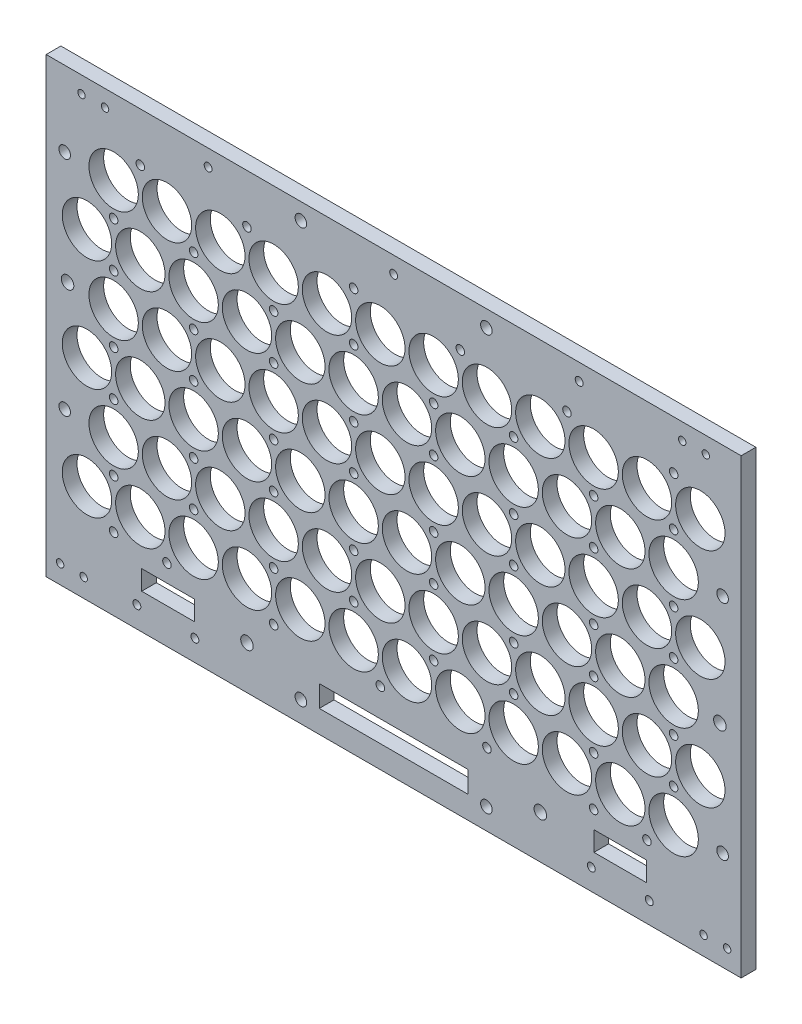
from build123d import *

# Parameters (mm, degrees)
SKETCH1_W                  = 299.700000132
SKETCH1_H                  = 194.250000104
BOSS_EXTRUDE1_DEPTH        = 6.35
SKETCH3_R                  = 10.6511979
CUT_EXTRUDE1_DEPTH         = 182.719853184
SKETCH4_R                  = 10.6511979
CUT_EXTRUDE2_DEPTH         = 182.719853184
LPATTERN1_COUNT            = 12
LPATTERN1_PITCH            = 23
LPATTERN2_COPY_1_SKETCH_R  = 10.6511979
LPATTERN2_COPY_1_DEPTH     = 182.719853184
LPATTERN2_COPY_2_SKETCH_R  = 10.6511979
LPATTERN2_COPY_2_DEPTH     = 182.719853184
LPATTERN2_COPY_3_SKETCH_R  = 10.6511979
LPATTERN2_COPY_3_DEPTH     = 182.719853184
LPATTERN2_COPY_4_SKETCH_R  = 10.6511979
LPATTERN2_COPY_4_DEPTH     = 182.719853184
LPATTERN2_COPY_5_SKETCH_R  = 10.6511979
LPATTERN2_COPY_5_DEPTH     = 182.719853184
LPATTERN2_COPY_6_SKETCH_R  = 10.6511979
LPATTERN2_COPY_6_DEPTH     = 182.719853184
LPATTERN2_COPY_7_SKETCH_R  = 10.6511979
LPATTERN2_COPY_7_DEPTH     = 182.719853184
LPATTERN2_COPY_8_SKETCH_R  = 10.6511979
LPATTERN2_COPY_8_DEPTH     = 182.719853184
LPATTERN2_COPY_9_SKETCH_R  = 10.6511979
LPATTERN2_COPY_9_DEPTH     = 182.719853184
LPATTERN2_COPY_10_SKETCH_R = 10.6511979
LPATTERN2_COPY_10_DEPTH    = 182.719853184
LPATTERN2_COPY_11_SKETCH_R = 10.6511979
LPATTERN2_COPY_11_DEPTH    = 182.719853184
LPATTERN2_COPY_12_SKETCH_R = 10.6511979
LPATTERN2_COPY_12_DEPTH    = 182.719853184
LPATTERN2_COPY_13_SKETCH_R = 10.6511979
LPATTERN2_COPY_13_DEPTH    = 182.719853184
LPATTERN2_COPY_14_SKETCH_R = 10.6511979
LPATTERN2_COPY_14_DEPTH    = 182.719853184
LPATTERN2_COPY_15_SKETCH_R = 10.6511979
LPATTERN2_COPY_15_DEPTH    = 182.719853184
LPATTERN2_COPY_16_SKETCH_R = 10.6511979
LPATTERN2_COPY_16_DEPTH    = 182.719853184
LPATTERN2_COPY_17_SKETCH_R = 10.6511979
LPATTERN2_COPY_17_DEPTH    = 182.719853184
LPATTERN2_COPY_18_SKETCH_R = 10.6511979
LPATTERN2_COPY_18_DEPTH    = 182.719853184
LPATTERN2_COPY_19_SKETCH_R = 10.6511979
LPATTERN2_COPY_19_DEPTH    = 182.719853184
LPATTERN2_COPY_20_SKETCH_R = 10.6511979
LPATTERN2_COPY_20_DEPTH    = 182.719853184
LPATTERN2_COPY_21_SKETCH_R = 10.6511979
LPATTERN2_COPY_21_DEPTH    = 182.719853184
LPATTERN2_COPY_22_SKETCH_R = 10.6511979
LPATTERN2_COPY_22_DEPTH    = 182.719853184
LPATTERN2_COPY_23_SKETCH_R = 10.6511979
LPATTERN2_COPY_23_DEPTH    = 182.719853184
LPATTERN2_COPY_24_SKETCH_R = 10.6511979
LPATTERN2_COPY_24_DEPTH    = 182.719853184
LPATTERN2_COPY_25_SKETCH_R = 10.6511979
LPATTERN2_COPY_25_DEPTH    = 182.719853184
LPATTERN2_COPY_26_SKETCH_R = 10.6511979
LPATTERN2_COPY_26_DEPTH    = 182.719853184
LPATTERN2_COPY_27_SKETCH_R = 10.6511979
LPATTERN2_COPY_27_DEPTH    = 182.719853184
LPATTERN2_COPY_28_SKETCH_R = 10.6511979
LPATTERN2_COPY_28_DEPTH    = 182.719853184
LPATTERN2_COPY_29_SKETCH_R = 10.6511979
LPATTERN2_COPY_29_DEPTH    = 182.719853184
LPATTERN2_COPY_30_SKETCH_R = 10.6511979
LPATTERN2_COPY_30_DEPTH    = 182.719853184
LPATTERN2_COPY_31_SKETCH_R = 10.6511979
LPATTERN2_COPY_31_DEPTH    = 182.719853184
LPATTERN2_COPY_32_SKETCH_R = 10.6511979
LPATTERN2_COPY_32_DEPTH    = 182.719853184
LPATTERN2_COPY_33_SKETCH_R = 10.6511979
LPATTERN2_COPY_33_DEPTH    = 182.719853184
LPATTERN2_COPY_34_SKETCH_R = 10.6511979
LPATTERN2_COPY_34_DEPTH    = 182.719853184
LPATTERN2_COPY_35_SKETCH_R = 10.6511979
LPATTERN2_COPY_35_DEPTH    = 182.719853184
LPATTERN2_COPY_36_SKETCH_R = 10.6511979
LPATTERN2_COPY_36_DEPTH    = 182.719853184
LPATTERN2_COPY_37_SKETCH_R = 10.6511979
LPATTERN2_COPY_37_DEPTH    = 182.719853184
LPATTERN2_COPY_38_SKETCH_R = 10.6511979
LPATTERN2_COPY_38_DEPTH    = 182.719853184
LPATTERN2_COPY_39_SKETCH_R = 10.6511979
LPATTERN2_COPY_39_DEPTH    = 182.719853184
LPATTERN2_COPY_40_SKETCH_R = 10.6511979
LPATTERN2_COPY_40_DEPTH    = 182.719853184
LPATTERN2_COPY_41_SKETCH_R = 10.6511979
LPATTERN2_COPY_41_DEPTH    = 182.719853184
LPATTERN2_COPY_42_SKETCH_R = 10.6511979
LPATTERN2_COPY_42_DEPTH    = 182.719853184
LPATTERN2_COPY_43_SKETCH_R = 10.6511979
LPATTERN2_COPY_43_DEPTH    = 182.719853184
LPATTERN2_COPY_44_SKETCH_R = 10.6511979
LPATTERN2_COPY_44_DEPTH    = 182.719853184
LPATTERN2_COPY_45_SKETCH_R = 10.6511979
LPATTERN2_COPY_45_DEPTH    = 182.719853184
LPATTERN2_COPY_46_SKETCH_R = 10.6511979
LPATTERN2_COPY_46_DEPTH    = 182.719853184
LPATTERN2_COPY_47_SKETCH_R = 10.6511979
LPATTERN2_COPY_47_DEPTH    = 182.719853184
LPATTERN2_COPY_48_SKETCH_R = 10.6511979
LPATTERN2_COPY_48_DEPTH    = 182.719853184
SKETCH5_W                  = 22.76
SKETCH5_H                  = 8.4615
CUT_EXTRUDE3_DEPTH         = 182.719853184
M3_CLEARANCE_HOLE1_D       = 3.2
M3_CLEARANCE_HOLE2_D       = 3.4
SKETCH14_R                 = 2.7
CUT_EXTRUDE4_DEPTH         = 182.719853184
SKETCH15_R                 = 2.5
CUT_EXTRUDE5_DEPTH         = 182.719853184
SKETCH18_R                 = 1.8415
CUT_EXTRUDE7_DEPTH         = 182.719853184
SKETCH19_W                 = 299.700000132
SKETCH19_H                 = 6.35
BOSS_EXTRUDE2_DEPTH        = 0.79375
SKETCH22_R                 = 1.8415
CUT_EXTRUDE8_DEPTH         = 182.719853184
LPATTERN3_COUNT            = 3
LPATTERN3_PITCH            = 48
SKETCH23_R                 = 1.8415
CUT_EXTRUDE9_DEPTH         = 182.719853184
LPATTERN4_COUNT            = 2
LPATTERN4_PITCH            = 48
LPATTERN5_COUNT            = 4
LPATTERN5_PITCH            = 69
LPATTERN5_COPY_1_SKETCH_R  = 1.8415
LPATTERN5_COPY_1_DEPTH     = 182.719853184
LPATTERN5_COPY_2_SKETCH_R  = 1.8415
LPATTERN5_COPY_2_DEPTH     = 182.719853184
LPATTERN5_COPY_3_SKETCH_R  = 1.8415
LPATTERN5_COPY_3_DEPTH     = 182.719853184
LPATTERN5_COPY_4_SKETCH_R  = 1.8415
LPATTERN5_COPY_4_DEPTH     = 182.719853184
LPATTERN5_COPY_5_SKETCH_R  = 1.8415
LPATTERN5_COPY_5_DEPTH     = 182.719853184
LPATTERN5_COPY_6_SKETCH_R  = 1.8415
LPATTERN5_COPY_6_DEPTH     = 182.719853184
LPATTERN5_COPY_7_SKETCH_R  = 1.8415
LPATTERN5_COPY_7_DEPTH     = 182.719853184
LPATTERN5_COPY_8_SKETCH_R  = 1.8415
LPATTERN5_COPY_8_DEPTH     = 182.719853184
LPATTERN5_COPY_9_SKETCH_R  = 1.8415
LPATTERN5_COPY_9_DEPTH     = 182.719853184
M3_CLEARANCE_HOLE3_D       = 3.4
SKETCH31_W                 = 64.135
SKETCH31_H                 = 9.275
CUT_EXTRUDE10_DEPTH        = 182.719853184


with BuildPart() as part:
    # Sketch1 → Boss-Extrude1 (new body)
    with BuildSketch(Plane.XY):
        with Locations((0, -5.475000052)):
            Rectangle(SKETCH1_W, SKETCH1_H)
    extrude(amount=BOSS_EXTRUDE1_DEPTH)

    # Sketch3 → Cut-Extrude1 (cut, through all)
    with BuildSketch(Plane.XY.offset(6.35)):
        with Locations((-132.25, -60)):
            Circle(SKETCH3_R)
    cut_extrude1 = extrude(amount=-CUT_EXTRUDE1_DEPTH, mode=Mode.SUBTRACT)

    # Sketch4 → Cut-Extrude2 (cut, through all)
    with BuildSketch(Plane.XY.offset(6.35)):
        with Locations((-120.75, -36)):
            Circle(SKETCH4_R)
    cut_extrude2 = extrude(amount=-CUT_EXTRUDE2_DEPTH, mode=Mode.SUBTRACT)

    # LPattern1: Cut-Extrude1, Cut-Extrude2 ×12
    with Locations(*[(i * LPATTERN1_PITCH, 0, 0) for i in range(1, LPATTERN1_COUNT)]):
        add(cut_extrude1, mode=Mode.SUBTRACT)
        add(cut_extrude2, mode=Mode.SUBTRACT)

    # LPattern2 copy 1 sketch → LPattern2 copy 1 (cut, through all)
    with BuildSketch(Plane(origin=(23, 48, 6.35), x_dir=(1, 0, 0), z_dir=(0, 0, 1))):
        with Locations((-132.25, -60)):
            Circle(LPATTERN2_COPY_1_SKETCH_R)
    extrude(amount=-LPATTERN2_COPY_1_DEPTH, mode=Mode.SUBTRACT)

    # LPattern2 copy 2 sketch → LPattern2 copy 2 (cut, through all)
    with BuildSketch(Plane(origin=(23, 96, 6.35), x_dir=(1, 0, 0), z_dir=(0, 0, 1))):
        with Locations((-132.25, -60)):
            Circle(LPATTERN2_COPY_2_SKETCH_R)
    extrude(amount=-LPATTERN2_COPY_2_DEPTH, mode=Mode.SUBTRACT)

    # LPattern2 copy 3 sketch → LPattern2 copy 3 (cut, through all)
    with BuildSketch(Plane(origin=(46, 48, 6.35), x_dir=(1, 0, 0), z_dir=(0, 0, 1))):
        with Locations((-132.25, -60)):
            Circle(LPATTERN2_COPY_3_SKETCH_R)
    extrude(amount=-LPATTERN2_COPY_3_DEPTH, mode=Mode.SUBTRACT)

    # LPattern2 copy 4 sketch → LPattern2 copy 4 (cut, through all)
    with BuildSketch(Plane(origin=(46, 96, 6.35), x_dir=(1, 0, 0), z_dir=(0, 0, 1))):
        with Locations((-132.25, -60)):
            Circle(LPATTERN2_COPY_4_SKETCH_R)
    extrude(amount=-LPATTERN2_COPY_4_DEPTH, mode=Mode.SUBTRACT)

    # LPattern2 copy 5 sketch → LPattern2 copy 5 (cut, through all)
    with BuildSketch(Plane(origin=(69, 48, 6.35), x_dir=(1, 0, 0), z_dir=(0, 0, 1))):
        with Locations((-132.25, -60)):
            Circle(LPATTERN2_COPY_5_SKETCH_R)
    extrude(amount=-LPATTERN2_COPY_5_DEPTH, mode=Mode.SUBTRACT)

    # LPattern2 copy 6 sketch → LPattern2 copy 6 (cut, through all)
    with BuildSketch(Plane(origin=(69, 96, 6.35), x_dir=(1, 0, 0), z_dir=(0, 0, 1))):
        with Locations((-132.25, -60)):
            Circle(LPATTERN2_COPY_6_SKETCH_R)
    extrude(amount=-LPATTERN2_COPY_6_DEPTH, mode=Mode.SUBTRACT)

    # LPattern2 copy 7 sketch → LPattern2 copy 7 (cut, through all)
    with BuildSketch(Plane(origin=(92, 48, 6.35), x_dir=(1, 0, 0), z_dir=(0, 0, 1))):
        with Locations((-132.25, -60)):
            Circle(LPATTERN2_COPY_7_SKETCH_R)
    extrude(amount=-LPATTERN2_COPY_7_DEPTH, mode=Mode.SUBTRACT)

    # LPattern2 copy 8 sketch → LPattern2 copy 8 (cut, through all)
    with BuildSketch(Plane(origin=(92, 96, 6.35), x_dir=(1, 0, 0), z_dir=(0, 0, 1))):
        with Locations((-132.25, -60)):
            Circle(LPATTERN2_COPY_8_SKETCH_R)
    extrude(amount=-LPATTERN2_COPY_8_DEPTH, mode=Mode.SUBTRACT)

    # LPattern2 copy 9 sketch → LPattern2 copy 9 (cut, through all)
    with BuildSketch(Plane(origin=(115, 48, 6.35), x_dir=(1, 0, 0), z_dir=(0, 0, 1))):
        with Locations((-132.25, -60)):
            Circle(LPATTERN2_COPY_9_SKETCH_R)
    extrude(amount=-LPATTERN2_COPY_9_DEPTH, mode=Mode.SUBTRACT)

    # LPattern2 copy 10 sketch → LPattern2 copy 10 (cut, through all)
    with BuildSketch(Plane(origin=(115, 96, 6.35), x_dir=(1, 0, 0), z_dir=(0, 0, 1))):
        with Locations((-132.25, -60)):
            Circle(LPATTERN2_COPY_10_SKETCH_R)
    extrude(amount=-LPATTERN2_COPY_10_DEPTH, mode=Mode.SUBTRACT)

    # LPattern2 copy 11 sketch → LPattern2 copy 11 (cut, through all)
    with BuildSketch(Plane(origin=(138, 48, 6.35), x_dir=(1, 0, 0), z_dir=(0, 0, 1))):
        with Locations((-132.25, -60)):
            Circle(LPATTERN2_COPY_11_SKETCH_R)
    extrude(amount=-LPATTERN2_COPY_11_DEPTH, mode=Mode.SUBTRACT)

    # LPattern2 copy 12 sketch → LPattern2 copy 12 (cut, through all)
    with BuildSketch(Plane(origin=(138, 96, 6.35), x_dir=(1, 0, 0), z_dir=(0, 0, 1))):
        with Locations((-132.25, -60)):
            Circle(LPATTERN2_COPY_12_SKETCH_R)
    extrude(amount=-LPATTERN2_COPY_12_DEPTH, mode=Mode.SUBTRACT)

    # LPattern2 copy 13 sketch → LPattern2 copy 13 (cut, through all)
    with BuildSketch(Plane(origin=(161, 48, 6.35), x_dir=(1, 0, 0), z_dir=(0, 0, 1))):
        with Locations((-132.25, -60)):
            Circle(LPATTERN2_COPY_13_SKETCH_R)
    extrude(amount=-LPATTERN2_COPY_13_DEPTH, mode=Mode.SUBTRACT)

    # LPattern2 copy 14 sketch → LPattern2 copy 14 (cut, through all)
    with BuildSketch(Plane(origin=(161, 96, 6.35), x_dir=(1, 0, 0), z_dir=(0, 0, 1))):
        with Locations((-132.25, -60)):
            Circle(LPATTERN2_COPY_14_SKETCH_R)
    extrude(amount=-LPATTERN2_COPY_14_DEPTH, mode=Mode.SUBTRACT)

    # LPattern2 copy 15 sketch → LPattern2 copy 15 (cut, through all)
    with BuildSketch(Plane(origin=(184, 48, 6.35), x_dir=(1, 0, 0), z_dir=(0, 0, 1))):
        with Locations((-132.25, -60)):
            Circle(LPATTERN2_COPY_15_SKETCH_R)
    extrude(amount=-LPATTERN2_COPY_15_DEPTH, mode=Mode.SUBTRACT)

    # LPattern2 copy 16 sketch → LPattern2 copy 16 (cut, through all)
    with BuildSketch(Plane(origin=(184, 96, 6.35), x_dir=(1, 0, 0), z_dir=(0, 0, 1))):
        with Locations((-132.25, -60)):
            Circle(LPATTERN2_COPY_16_SKETCH_R)
    extrude(amount=-LPATTERN2_COPY_16_DEPTH, mode=Mode.SUBTRACT)

    # LPattern2 copy 17 sketch → LPattern2 copy 17 (cut, through all)
    with BuildSketch(Plane(origin=(207, 48, 6.35), x_dir=(1, 0, 0), z_dir=(0, 0, 1))):
        with Locations((-132.25, -60)):
            Circle(LPATTERN2_COPY_17_SKETCH_R)
    extrude(amount=-LPATTERN2_COPY_17_DEPTH, mode=Mode.SUBTRACT)

    # LPattern2 copy 18 sketch → LPattern2 copy 18 (cut, through all)
    with BuildSketch(Plane(origin=(207, 96, 6.35), x_dir=(1, 0, 0), z_dir=(0, 0, 1))):
        with Locations((-132.25, -60)):
            Circle(LPATTERN2_COPY_18_SKETCH_R)
    extrude(amount=-LPATTERN2_COPY_18_DEPTH, mode=Mode.SUBTRACT)

    # LPattern2 copy 19 sketch → LPattern2 copy 19 (cut, through all)
    with BuildSketch(Plane(origin=(230, 48, 6.35), x_dir=(1, 0, 0), z_dir=(0, 0, 1))):
        with Locations((-132.25, -60)):
            Circle(LPATTERN2_COPY_19_SKETCH_R)
    extrude(amount=-LPATTERN2_COPY_19_DEPTH, mode=Mode.SUBTRACT)

    # LPattern2 copy 20 sketch → LPattern2 copy 20 (cut, through all)
    with BuildSketch(Plane(origin=(230, 96, 6.35), x_dir=(1, 0, 0), z_dir=(0, 0, 1))):
        with Locations((-132.25, -60)):
            Circle(LPATTERN2_COPY_20_SKETCH_R)
    extrude(amount=-LPATTERN2_COPY_20_DEPTH, mode=Mode.SUBTRACT)

    # LPattern2 copy 21 sketch → LPattern2 copy 21 (cut, through all)
    with BuildSketch(Plane(origin=(253, 48, 6.35), x_dir=(1, 0, 0), z_dir=(0, 0, 1))):
        with Locations((-132.25, -60)):
            Circle(LPATTERN2_COPY_21_SKETCH_R)
    extrude(amount=-LPATTERN2_COPY_21_DEPTH, mode=Mode.SUBTRACT)

    # LPattern2 copy 22 sketch → LPattern2 copy 22 (cut, through all)
    with BuildSketch(Plane(origin=(253, 96, 6.35), x_dir=(1, 0, 0), z_dir=(0, 0, 1))):
        with Locations((-132.25, -60)):
            Circle(LPATTERN2_COPY_22_SKETCH_R)
    extrude(amount=-LPATTERN2_COPY_22_DEPTH, mode=Mode.SUBTRACT)

    # LPattern2 copy 23 sketch → LPattern2 copy 23 (cut, through all)
    with BuildSketch(Plane(origin=(23, 48, 6.35), x_dir=(1, 0, 0), z_dir=(0, 0, 1))):
        with Locations((-120.75, -36)):
            Circle(LPATTERN2_COPY_23_SKETCH_R)
    extrude(amount=-LPATTERN2_COPY_23_DEPTH, mode=Mode.SUBTRACT)

    # LPattern2 copy 24 sketch → LPattern2 copy 24 (cut, through all)
    with BuildSketch(Plane(origin=(23, 96, 6.35), x_dir=(1, 0, 0), z_dir=(0, 0, 1))):
        with Locations((-120.75, -36)):
            Circle(LPATTERN2_COPY_24_SKETCH_R)
    extrude(amount=-LPATTERN2_COPY_24_DEPTH, mode=Mode.SUBTRACT)

    # LPattern2 copy 25 sketch → LPattern2 copy 25 (cut, through all)
    with BuildSketch(Plane(origin=(46, 48, 6.35), x_dir=(1, 0, 0), z_dir=(0, 0, 1))):
        with Locations((-120.75, -36)):
            Circle(LPATTERN2_COPY_25_SKETCH_R)
    extrude(amount=-LPATTERN2_COPY_25_DEPTH, mode=Mode.SUBTRACT)

    # LPattern2 copy 26 sketch → LPattern2 copy 26 (cut, through all)
    with BuildSketch(Plane(origin=(46, 96, 6.35), x_dir=(1, 0, 0), z_dir=(0, 0, 1))):
        with Locations((-120.75, -36)):
            Circle(LPATTERN2_COPY_26_SKETCH_R)
    extrude(amount=-LPATTERN2_COPY_26_DEPTH, mode=Mode.SUBTRACT)

    # LPattern2 copy 27 sketch → LPattern2 copy 27 (cut, through all)
    with BuildSketch(Plane(origin=(69, 48, 6.35), x_dir=(1, 0, 0), z_dir=(0, 0, 1))):
        with Locations((-120.75, -36)):
            Circle(LPATTERN2_COPY_27_SKETCH_R)
    extrude(amount=-LPATTERN2_COPY_27_DEPTH, mode=Mode.SUBTRACT)

    # LPattern2 copy 28 sketch → LPattern2 copy 28 (cut, through all)
    with BuildSketch(Plane(origin=(69, 96, 6.35), x_dir=(1, 0, 0), z_dir=(0, 0, 1))):
        with Locations((-120.75, -36)):
            Circle(LPATTERN2_COPY_28_SKETCH_R)
    extrude(amount=-LPATTERN2_COPY_28_DEPTH, mode=Mode.SUBTRACT)

    # LPattern2 copy 29 sketch → LPattern2 copy 29 (cut, through all)
    with BuildSketch(Plane(origin=(92, 48, 6.35), x_dir=(1, 0, 0), z_dir=(0, 0, 1))):
        with Locations((-120.75, -36)):
            Circle(LPATTERN2_COPY_29_SKETCH_R)
    extrude(amount=-LPATTERN2_COPY_29_DEPTH, mode=Mode.SUBTRACT)

    # LPattern2 copy 30 sketch → LPattern2 copy 30 (cut, through all)
    with BuildSketch(Plane(origin=(92, 96, 6.35), x_dir=(1, 0, 0), z_dir=(0, 0, 1))):
        with Locations((-120.75, -36)):
            Circle(LPATTERN2_COPY_30_SKETCH_R)
    extrude(amount=-LPATTERN2_COPY_30_DEPTH, mode=Mode.SUBTRACT)

    # LPattern2 copy 31 sketch → LPattern2 copy 31 (cut, through all)
    with BuildSketch(Plane(origin=(115, 48, 6.35), x_dir=(1, 0, 0), z_dir=(0, 0, 1))):
        with Locations((-120.75, -36)):
            Circle(LPATTERN2_COPY_31_SKETCH_R)
    extrude(amount=-LPATTERN2_COPY_31_DEPTH, mode=Mode.SUBTRACT)

    # LPattern2 copy 32 sketch → LPattern2 copy 32 (cut, through all)
    with BuildSketch(Plane(origin=(115, 96, 6.35), x_dir=(1, 0, 0), z_dir=(0, 0, 1))):
        with Locations((-120.75, -36)):
            Circle(LPATTERN2_COPY_32_SKETCH_R)
    extrude(amount=-LPATTERN2_COPY_32_DEPTH, mode=Mode.SUBTRACT)

    # LPattern2 copy 33 sketch → LPattern2 copy 33 (cut, through all)
    with BuildSketch(Plane(origin=(138, 48, 6.35), x_dir=(1, 0, 0), z_dir=(0, 0, 1))):
        with Locations((-120.75, -36)):
            Circle(LPATTERN2_COPY_33_SKETCH_R)
    extrude(amount=-LPATTERN2_COPY_33_DEPTH, mode=Mode.SUBTRACT)

    # LPattern2 copy 34 sketch → LPattern2 copy 34 (cut, through all)
    with BuildSketch(Plane(origin=(138, 96, 6.35), x_dir=(1, 0, 0), z_dir=(0, 0, 1))):
        with Locations((-120.75, -36)):
            Circle(LPATTERN2_COPY_34_SKETCH_R)
    extrude(amount=-LPATTERN2_COPY_34_DEPTH, mode=Mode.SUBTRACT)

    # LPattern2 copy 35 sketch → LPattern2 copy 35 (cut, through all)
    with BuildSketch(Plane(origin=(161, 48, 6.35), x_dir=(1, 0, 0), z_dir=(0, 0, 1))):
        with Locations((-120.75, -36)):
            Circle(LPATTERN2_COPY_35_SKETCH_R)
    extrude(amount=-LPATTERN2_COPY_35_DEPTH, mode=Mode.SUBTRACT)

    # LPattern2 copy 36 sketch → LPattern2 copy 36 (cut, through all)
    with BuildSketch(Plane(origin=(161, 96, 6.35), x_dir=(1, 0, 0), z_dir=(0, 0, 1))):
        with Locations((-120.75, -36)):
            Circle(LPATTERN2_COPY_36_SKETCH_R)
    extrude(amount=-LPATTERN2_COPY_36_DEPTH, mode=Mode.SUBTRACT)

    # LPattern2 copy 37 sketch → LPattern2 copy 37 (cut, through all)
    with BuildSketch(Plane(origin=(184, 48, 6.35), x_dir=(1, 0, 0), z_dir=(0, 0, 1))):
        with Locations((-120.75, -36)):
            Circle(LPATTERN2_COPY_37_SKETCH_R)
    extrude(amount=-LPATTERN2_COPY_37_DEPTH, mode=Mode.SUBTRACT)

    # LPattern2 copy 38 sketch → LPattern2 copy 38 (cut, through all)
    with BuildSketch(Plane(origin=(184, 96, 6.35), x_dir=(1, 0, 0), z_dir=(0, 0, 1))):
        with Locations((-120.75, -36)):
            Circle(LPATTERN2_COPY_38_SKETCH_R)
    extrude(amount=-LPATTERN2_COPY_38_DEPTH, mode=Mode.SUBTRACT)

    # LPattern2 copy 39 sketch → LPattern2 copy 39 (cut, through all)
    with BuildSketch(Plane(origin=(207, 48, 6.35), x_dir=(1, 0, 0), z_dir=(0, 0, 1))):
        with Locations((-120.75, -36)):
            Circle(LPATTERN2_COPY_39_SKETCH_R)
    extrude(amount=-LPATTERN2_COPY_39_DEPTH, mode=Mode.SUBTRACT)

    # LPattern2 copy 40 sketch → LPattern2 copy 40 (cut, through all)
    with BuildSketch(Plane(origin=(207, 96, 6.35), x_dir=(1, 0, 0), z_dir=(0, 0, 1))):
        with Locations((-120.75, -36)):
            Circle(LPATTERN2_COPY_40_SKETCH_R)
    extrude(amount=-LPATTERN2_COPY_40_DEPTH, mode=Mode.SUBTRACT)

    # LPattern2 copy 41 sketch → LPattern2 copy 41 (cut, through all)
    with BuildSketch(Plane(origin=(230, 48, 6.35), x_dir=(1, 0, 0), z_dir=(0, 0, 1))):
        with Locations((-120.75, -36)):
            Circle(LPATTERN2_COPY_41_SKETCH_R)
    extrude(amount=-LPATTERN2_COPY_41_DEPTH, mode=Mode.SUBTRACT)

    # LPattern2 copy 42 sketch → LPattern2 copy 42 (cut, through all)
    with BuildSketch(Plane(origin=(230, 96, 6.35), x_dir=(1, 0, 0), z_dir=(0, 0, 1))):
        with Locations((-120.75, -36)):
            Circle(LPATTERN2_COPY_42_SKETCH_R)
    extrude(amount=-LPATTERN2_COPY_42_DEPTH, mode=Mode.SUBTRACT)

    # LPattern2 copy 43 sketch → LPattern2 copy 43 (cut, through all)
    with BuildSketch(Plane(origin=(253, 48, 6.35), x_dir=(1, 0, 0), z_dir=(0, 0, 1))):
        with Locations((-120.75, -36)):
            Circle(LPATTERN2_COPY_43_SKETCH_R)
    extrude(amount=-LPATTERN2_COPY_43_DEPTH, mode=Mode.SUBTRACT)

    # LPattern2 copy 44 sketch → LPattern2 copy 44 (cut, through all)
    with BuildSketch(Plane(origin=(253, 96, 6.35), x_dir=(1, 0, 0), z_dir=(0, 0, 1))):
        with Locations((-120.75, -36)):
            Circle(LPATTERN2_COPY_44_SKETCH_R)
    extrude(amount=-LPATTERN2_COPY_44_DEPTH, mode=Mode.SUBTRACT)

    # LPattern2 copy 45 sketch → LPattern2 copy 45 (cut, through all)
    with BuildSketch(Plane(origin=(0, 48, 6.35), x_dir=(1, 0, 0), z_dir=(0, 0, 1))):
        with Locations((-132.25, -60)):
            Circle(LPATTERN2_COPY_45_SKETCH_R)
    extrude(amount=-LPATTERN2_COPY_45_DEPTH, mode=Mode.SUBTRACT)

    # LPattern2 copy 46 sketch → LPattern2 copy 46 (cut, through all)
    with BuildSketch(Plane(origin=(0, 96, 6.35), x_dir=(1, 0, 0), z_dir=(0, 0, 1))):
        with Locations((-132.25, -60)):
            Circle(LPATTERN2_COPY_46_SKETCH_R)
    extrude(amount=-LPATTERN2_COPY_46_DEPTH, mode=Mode.SUBTRACT)

    # LPattern2 copy 47 sketch → LPattern2 copy 47 (cut, through all)
    with BuildSketch(Plane(origin=(0, 48, 6.35), x_dir=(1, 0, 0), z_dir=(0, 0, 1))):
        with Locations((-120.75, -36)):
            Circle(LPATTERN2_COPY_47_SKETCH_R)
    extrude(amount=-LPATTERN2_COPY_47_DEPTH, mode=Mode.SUBTRACT)

    # LPattern2 copy 48 sketch → LPattern2 copy 48 (cut, through all)
    with BuildSketch(Plane(origin=(0, 96, 6.35), x_dir=(1, 0, 0), z_dir=(0, 0, 1))):
        with Locations((-120.75, -36)):
            Circle(LPATTERN2_COPY_48_SKETCH_R)
    extrude(amount=-LPATTERN2_COPY_48_DEPTH, mode=Mode.SUBTRACT)

    # Sketch5 → Cut-Extrude3 (cut, through all)
    with BuildSketch(Plane.XY.offset(6.35)):
        with Locations((97.75, -83.18075)):
            Rectangle(SKETCH5_W, SKETCH5_H)
        with Locations((-97.288, -83.18075)):
            Rectangle(SKETCH5_W, SKETCH5_H)
    extrude(amount=-CUT_EXTRUDE3_DEPTH, mode=Mode.SUBTRACT)

    # M3 Clearance Hole1 (through all)
    with Locations(Plane.XY.offset(6.35)):
        with Locations((124.450000066, 85.3), (134.610000066, 85.3), (-124.450000066, 85.3), (-134.610000066, 85.3), (-143.817500066, -94.6000001), (-133.657500066, -94.6000001), (133.657500066, -94.6000001), (143.817500066, -94.6000001)):
            Hole(M3_CLEARANCE_HOLE1_D / 2)

    # M3 Clearance Hole2 (through all)
    with Locations(Plane.XY.offset(6.35)):
        with Locations((110.25, -93.50575), (85.25, -93.50575), (-80, 85.3), (0, 85.3), (80, 85.3)):
            Hole(M3_CLEARANCE_HOLE2_D / 2)

    # Sketch14 → Cut-Extrude4 (cut, through all)
    with BuildSketch(Plane.XY.offset(6.35)):
        with Locations((140.687500033, -12)):
            Circle(SKETCH14_R)
        with Locations((-140.625598983, 12)):
            Circle(SKETCH14_R)
        with Locations((63.25, -83.95)):
            Circle(SKETCH14_R)
        with Locations((-63.25, -83.95)):
            Circle(SKETCH14_R)
    extrude(amount=-CUT_EXTRUDE4_DEPTH, mode=Mode.SUBTRACT)

    # Sketch15 → Cut-Extrude5 (cut, through all)
    with BuildSketch(Plane.XY.offset(6.35)):
        with Locations((-40, 85.3)):
            Circle(SKETCH15_R)
        with Locations((40, 85.3)):
            Circle(SKETCH15_R)
        with Locations((141.850000066, 36)):
            Circle(SKETCH15_R)
        with Locations((141.850000066, -60)):
            Circle(SKETCH15_R)
        with Locations((-141.850000066, -36)):
            Circle(SKETCH15_R)
        with Locations((-141.850000066, 60)):
            Circle(SKETCH15_R)
        with Locations((-40, -93.50575)):
            Circle(SKETCH15_R)
        with Locations((40, -93.50575)):
            Circle(SKETCH15_R)
    extrude(amount=-CUT_EXTRUDE5_DEPTH, mode=Mode.SUBTRACT)

    # Sketch18 → Cut-Extrude7 (cut, through all)
    with BuildSketch(Plane.XY.offset(6.35)):
        with Locations((109.25, -71.41)):
            Circle(SKETCH18_R)
        with Locations((86.25, -71.41)):
            Circle(SKETCH18_R)
        with Locations((120.75, 71.41)):
            Circle(SKETCH18_R)
        with Locations((74.75, 71.41)):
            Circle(SKETCH18_R)
        with Locations((28.75, 71.41)):
            Circle(SKETCH18_R)
        with Locations((-17.25, 71.41)):
            Circle(SKETCH18_R)
        with Locations((-63.25, 71.41)):
            Circle(SKETCH18_R)
        with Locations((-109.25, 71.41)):
            Circle(SKETCH18_R)
        with Locations((40.25, -71.41)):
            Circle(SKETCH18_R)
        with Locations((-5.75, -71.41)):
            Circle(SKETCH18_R)
        with Locations((-51.75, -71.41)):
            Circle(SKETCH18_R)
        with Locations((-97.75, -71.41)):
            Circle(SKETCH18_R)
        with Locations((-120.75, -71.41)):
            Circle(SKETCH18_R)
    extrude(amount=-CUT_EXTRUDE7_DEPTH, mode=Mode.SUBTRACT)

    # Sketch19 → Boss-Extrude2 (add)
    with BuildSketch(Plane(origin=(0, 91.65, 0), x_dir=(1, 0, 0), z_dir=(0, 1, 0))):
        with Locations((0, -3.175)):
            Rectangle(SKETCH19_W, SKETCH19_H)
    extrude(amount=BOSS_EXTRUDE2_DEPTH)

    # Sketch22 → Cut-Extrude8 (cut, through all)
    with BuildSketch(Plane.XY.offset(6.35)):
        with Locations((120.75, -45.605420991)):
            Circle(SKETCH22_R)
        with Locations((86.25, -50.28293229)):
            Circle(SKETCH22_R)
    cut_extrude8 = extrude(amount=-CUT_EXTRUDE8_DEPTH, mode=Mode.SUBTRACT)

    # LPattern3: Cut-Extrude8 ×3
    with Locations(*[(0, i * LPATTERN3_PITCH, 0) for i in range(1, LPATTERN3_COUNT)]):
        add(cut_extrude8, mode=Mode.SUBTRACT)

    # Sketch23 → Cut-Extrude9 (cut, through all)
    with BuildSketch(Plane.XY.offset(6.35)):
        with Locations((120.75, -26.394579009)):
            Circle(SKETCH23_R)
        with Locations((86.25, -21.71706771)):
            Circle(SKETCH23_R)
    cut_extrude9 = extrude(amount=-CUT_EXTRUDE9_DEPTH, mode=Mode.SUBTRACT)

    # LPattern4: Cut-Extrude9 ×2
    with Locations(*[(0, i * LPATTERN4_PITCH, 0) for i in range(1, LPATTERN4_COUNT)]):
        add(cut_extrude9, mode=Mode.SUBTRACT)

    # LPattern5: Cut-Extrude8, Cut-Extrude9 ×4
    with Locations(*[(-i * LPATTERN5_PITCH, 0, 0) for i in range(1, LPATTERN5_COUNT)]):
        add(cut_extrude8, mode=Mode.SUBTRACT)
        add(cut_extrude9, mode=Mode.SUBTRACT)

    # LPattern5 copy 1 sketch → LPattern5 copy 1 (cut, through all)
    with BuildSketch(Plane(origin=(-69, 48, 6.35), x_dir=(1, 0, 0), z_dir=(0, 0, 1))):
        with Locations((120.75, -45.605420991)):
            Circle(LPATTERN5_COPY_1_SKETCH_R)
        with Locations((86.25, -50.28293229)):
            Circle(LPATTERN5_COPY_1_SKETCH_R)
    extrude(amount=-LPATTERN5_COPY_1_DEPTH, mode=Mode.SUBTRACT)

    # LPattern5 copy 2 sketch → LPattern5 copy 2 (cut, through all)
    with BuildSketch(Plane(origin=(-138, 48, 6.35), x_dir=(1, 0, 0), z_dir=(0, 0, 1))):
        with Locations((120.75, -45.605420991)):
            Circle(LPATTERN5_COPY_2_SKETCH_R)
        with Locations((86.25, -50.28293229)):
            Circle(LPATTERN5_COPY_2_SKETCH_R)
    extrude(amount=-LPATTERN5_COPY_2_DEPTH, mode=Mode.SUBTRACT)

    # LPattern5 copy 3 sketch → LPattern5 copy 3 (cut, through all)
    with BuildSketch(Plane(origin=(-207, 48, 6.35), x_dir=(1, 0, 0), z_dir=(0, 0, 1))):
        with Locations((120.75, -45.605420991)):
            Circle(LPATTERN5_COPY_3_SKETCH_R)
        with Locations((86.25, -50.28293229)):
            Circle(LPATTERN5_COPY_3_SKETCH_R)
    extrude(amount=-LPATTERN5_COPY_3_DEPTH, mode=Mode.SUBTRACT)

    # LPattern5 copy 4 sketch → LPattern5 copy 4 (cut, through all)
    with BuildSketch(Plane(origin=(-69, 96, 6.35), x_dir=(1, 0, 0), z_dir=(0, 0, 1))):
        with Locations((120.75, -45.605420991)):
            Circle(LPATTERN5_COPY_4_SKETCH_R)
        with Locations((86.25, -50.28293229)):
            Circle(LPATTERN5_COPY_4_SKETCH_R)
    extrude(amount=-LPATTERN5_COPY_4_DEPTH, mode=Mode.SUBTRACT)

    # LPattern5 copy 5 sketch → LPattern5 copy 5 (cut, through all)
    with BuildSketch(Plane(origin=(-138, 96, 6.35), x_dir=(1, 0, 0), z_dir=(0, 0, 1))):
        with Locations((120.75, -45.605420991)):
            Circle(LPATTERN5_COPY_5_SKETCH_R)
        with Locations((86.25, -50.28293229)):
            Circle(LPATTERN5_COPY_5_SKETCH_R)
    extrude(amount=-LPATTERN5_COPY_5_DEPTH, mode=Mode.SUBTRACT)

    # LPattern5 copy 6 sketch → LPattern5 copy 6 (cut, through all)
    with BuildSketch(Plane(origin=(-207, 96, 6.35), x_dir=(1, 0, 0), z_dir=(0, 0, 1))):
        with Locations((120.75, -45.605420991)):
            Circle(LPATTERN5_COPY_6_SKETCH_R)
        with Locations((86.25, -50.28293229)):
            Circle(LPATTERN5_COPY_6_SKETCH_R)
    extrude(amount=-LPATTERN5_COPY_6_DEPTH, mode=Mode.SUBTRACT)

    # LPattern5 copy 7 sketch → LPattern5 copy 7 (cut, through all)
    with BuildSketch(Plane(origin=(-69, 48, 6.35), x_dir=(1, 0, 0), z_dir=(0, 0, 1))):
        with Locations((120.75, -26.394579009)):
            Circle(LPATTERN5_COPY_7_SKETCH_R)
        with Locations((86.25, -21.71706771)):
            Circle(LPATTERN5_COPY_7_SKETCH_R)
    extrude(amount=-LPATTERN5_COPY_7_DEPTH, mode=Mode.SUBTRACT)

    # LPattern5 copy 8 sketch → LPattern5 copy 8 (cut, through all)
    with BuildSketch(Plane(origin=(-138, 48, 6.35), x_dir=(1, 0, 0), z_dir=(0, 0, 1))):
        with Locations((120.75, -26.394579009)):
            Circle(LPATTERN5_COPY_8_SKETCH_R)
        with Locations((86.25, -21.71706771)):
            Circle(LPATTERN5_COPY_8_SKETCH_R)
    extrude(amount=-LPATTERN5_COPY_8_DEPTH, mode=Mode.SUBTRACT)

    # LPattern5 copy 9 sketch → LPattern5 copy 9 (cut, through all)
    with BuildSketch(Plane(origin=(-207, 48, 6.35), x_dir=(1, 0, 0), z_dir=(0, 0, 1))):
        with Locations((120.75, -26.394579009)):
            Circle(LPATTERN5_COPY_9_SKETCH_R)
        with Locations((86.25, -21.71706771)):
            Circle(LPATTERN5_COPY_9_SKETCH_R)
    extrude(amount=-LPATTERN5_COPY_9_DEPTH, mode=Mode.SUBTRACT)

    # M3 Clearance Hole3 (through all)
    with Locations(Plane.XY.offset(6.35)):
        with Locations((-85.712000066, -93.485979104), (-110.712000066, -93.485979104)):
            Hole(M3_CLEARANCE_HOLE3_D / 2)

    # Sketch31 → Cut-Extrude10 (cut, through all)
    with BuildSketch(Plane.XY.offset(6.35)):
        with Locations((0, -88.236252104)):
            Rectangle(SKETCH31_W, SKETCH31_H)
    extrude(amount=-CUT_EXTRUDE10_DEPTH, mode=Mode.SUBTRACT)


solid = part.part
